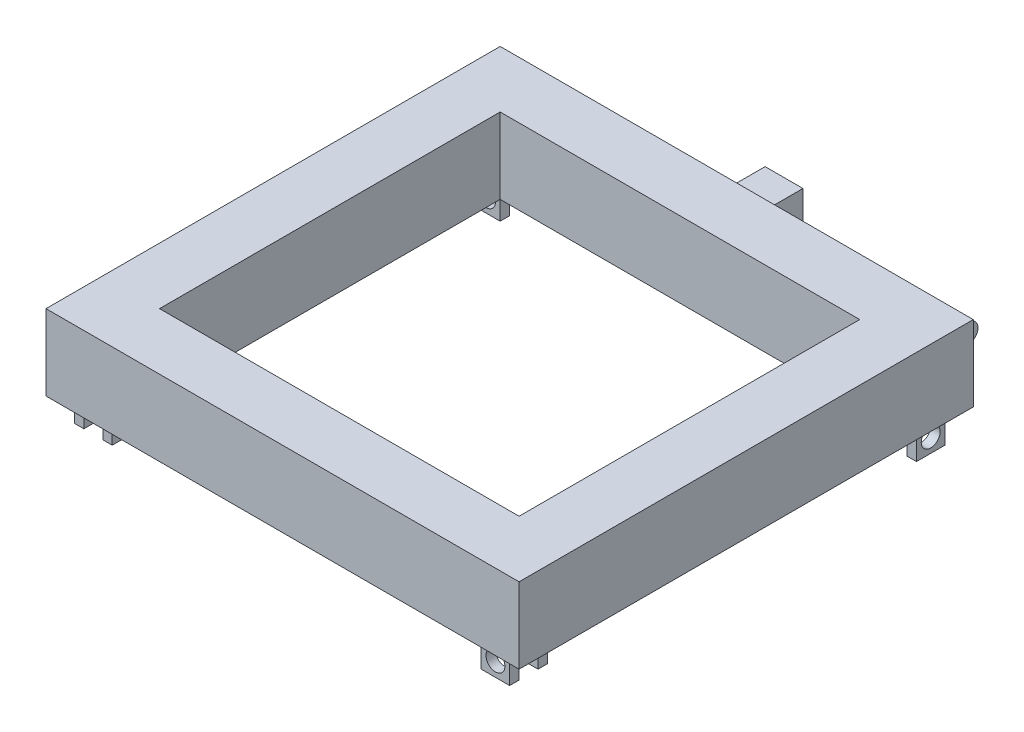
from build123d import *

# Parameters (mm, degrees)
SKETCH1_W           = 1270
SKETCH1_H           = 1219.2
BOSS_EXTRUDE1_DEPTH = 203.2
SKETCH2_W           = 965.2
SKETCH2_H           = 914.4
CUT_EXTRUDE2_DEPTH  = 203.2
SKETCH4_W           = 25.4
SKETCH4_H           = 76.2
SKETCH4_W_2         = 76.2
SKETCH4_H_2         = 25.4
BOSS_EXTRUDE2_DEPTH = 76.2
SKETCH6_R           = 25.4
CUT_EXTRUDE3_DEPTH  = 127
SKETCH7_R           = 25.4
CUT_EXTRUDE4_DEPTH  = 127
SKETCH8_R           = 25.4
CUT_EXTRUDE5_DEPTH  = 127
SKETCH9_R           = 25.4
CUT_EXTRUDE6_DEPTH  = 127
BOSS_EXTRUDE3_DEPTH = 127
SKETCH11_R          = 25.4
BOSS_EXTRUDE4_DEPTH = 508
BOSS_EXTRUDE5_START = 508
SKETCH12_R          = 25.4
BOSS_EXTRUDE5_DEPTH = 508


with BuildPart() as part:
    # Sketch1 → Boss-Extrude1 (new body)
    with BuildSketch(Plane(origin=(0, 0, 0), x_dir=(1, 0, 0), z_dir=(0, 1, 0))):
        with Locations((635, -609.6)):
            Rectangle(SKETCH1_W, SKETCH1_H)
    extrude(amount=BOSS_EXTRUDE1_DEPTH)

    # Sketch2 → Cut-Extrude2 (cut)
    with BuildSketch(Plane(origin=(0, 203.2, 0), x_dir=(1, 0, 0), z_dir=(0, 1, 0))):
        with Locations((635, -609.6)):
            Rectangle(SKETCH2_W, SKETCH2_H)
    extrude(amount=-CUT_EXTRUDE2_DEPTH, mode=Mode.SUBTRACT)

    # Sketch4 → Boss-Extrude2 (add)
    with BuildSketch(Plane(origin=(0, 0, 0), x_dir=(-1, 0, 0), z_dir=(0, -1, 0))):
        with Locations((-38.1, -1130.3)):
            Rectangle(SKETCH4_W, SKETCH4_H)
        with Locations((-114.3, -1130.3)):
            Rectangle(SKETCH4_W, SKETCH4_H)
        with Locations((-1181.1, -1181.1)):
            Rectangle(SKETCH4_W_2, SKETCH4_H_2)
        with Locations((-1181.1, -1104.9)):
            Rectangle(SKETCH4_W_2, SKETCH4_H_2)
        with Locations((-1231.9, -88.9)):
            Rectangle(SKETCH4_W, SKETCH4_H)
        with Locations((-1155.7, -88.9)):
            Rectangle(SKETCH4_W, SKETCH4_H)
        with Locations((-88.9, -114.3)):
            Rectangle(SKETCH4_W_2, SKETCH4_H_2)
        with Locations((-88.9, -38.1)):
            Rectangle(SKETCH4_W_2, SKETCH4_H_2)
    extrude(amount=BOSS_EXTRUDE2_DEPTH)

    # Sketch6 → Cut-Extrude3 (cut)
    with BuildSketch(Plane.ZY.offset(-25.4)):
        with Locations((1130.3, -38.1)):
            Circle(SKETCH6_R)
    extrude(amount=-CUT_EXTRUDE3_DEPTH, mode=Mode.SUBTRACT)

    # Sketch7 → Cut-Extrude4 (cut)
    with BuildSketch(Plane.XY.offset(1193.8)):
        with Locations((1181.1, -38.1)):
            Circle(SKETCH7_R)
    extrude(amount=-CUT_EXTRUDE4_DEPTH, mode=Mode.SUBTRACT)

    # Sketch8 → Cut-Extrude5 (cut)
    with BuildSketch(Plane(origin=(1244.6, 0, 0), x_dir=(0, 0, -1), z_dir=(1, 0, 0))):
        with Locations((-88.9, -38.1)):
            Circle(SKETCH8_R)
    extrude(amount=-CUT_EXTRUDE5_DEPTH, mode=Mode.SUBTRACT)

    # Sketch9 → Cut-Extrude6 (cut)
    with BuildSketch(Plane(origin=(0, 0, 25.4), x_dir=(-1, 0, 0), z_dir=(0, 0, -1))):
        with Locations((-88.9, -38.1)):
            Circle(SKETCH9_R)
    extrude(amount=-CUT_EXTRUDE6_DEPTH, mode=Mode.SUBTRACT)

    # Sketch10 → Boss-Extrude3 (add)
    with BuildSketch(Plane(origin=(0, 0, 0), x_dir=(-1, 0, 0), z_dir=(0, 0, -1))):
        Polygon((-584.2, 152.4), (-635, 152.4), (-685.8, 152.4), (-685.8, 50.8), (-584.2, 50.8), align=None)
    extrude(amount=BOSS_EXTRUDE3_DEPTH)

    # Sketch11 → Boss-Extrude4 (add)
    with BuildSketch(Plane.ZY.offset(-584.2)):
        with Locations((-63.5, 101.6)):
            Circle(SKETCH11_R)
    extrude(amount=BOSS_EXTRUDE4_DEPTH)

    # Sketch12 → Boss-Extrude5 (add)
    with BuildSketch(Plane(origin=(685.8, 0, 0), x_dir=(0, 0, -1), z_dir=(1, 0, 0)).offset(BOSS_EXTRUDE5_START)):
        with Locations(Location((63.5, 101.6, 0), (0, 0, 180))):
            Circle(SKETCH12_R)
    extrude(amount=-BOSS_EXTRUDE5_DEPTH)


solid = part.part
